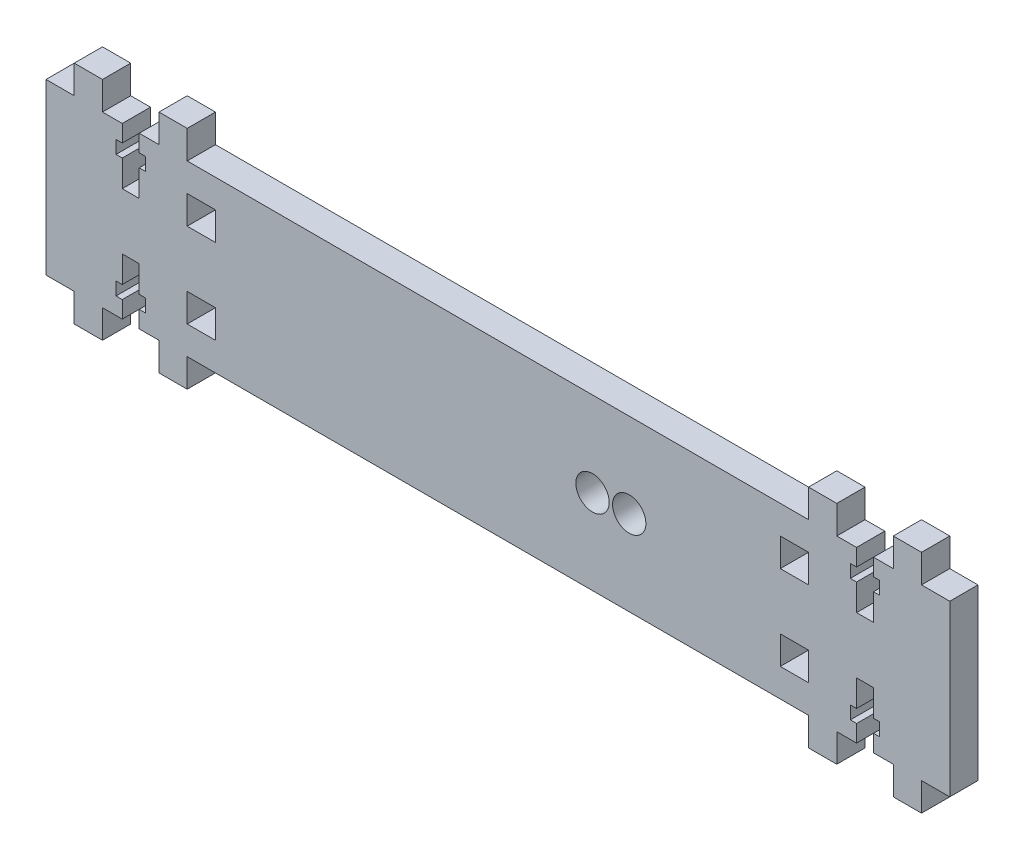
from build123d import *

# Parameters (mm, degrees)
SKETCH2_R           = 2.95
SKETCH2_W           = 5
SKETCH2_H           = 5
BOSS_EXTRUDE1_DEPTH = 5


with BuildPart() as part:
    # Sketch2 → Boss-Extrude1 (new body)
    with BuildSketch(Plane.XY):
        Polygon((66.5, 15), (70, 15), (70, 20), (75, 20), (75, 15), (80, 15), (80, -15), (75, -15), (75, -20), (70, -20), (70, -15), (66.5, -15), (66.5, -12), (67.6, -12), (67.6, -9.7), (66.5, -9.7), (66.5, -5), (63.5, -5), (63.5, -9.7), (62.4, -9.7), (62.4, -12), (63.5, -12), (63.5, -15), (60, -15), (60, -20), (55, -20), (55, -15), (-55, -15), (-55, -20), (-60, -20), (-60, -15), (-63.5, -15), (-63.5, -12), (-62.4, -12), (-62.4, -9.7), (-63.5, -9.7), (-63.5, -5), (-66.5, -5), (-66.5, -9.7), (-67.6, -9.7), (-67.6, -12), (-66.5, -12), (-66.5, -15), (-70, -15), (-70, -20), (-75, -20), (-75, -15), (-80, -15), (-80, 15), (-75, 15), (-75, 20), (-70, 20), (-70, 15), (-66.5, 15), (-66.5, 12), (-67.6, 12), (-67.6, 9.7), (-66.5, 9.7), (-66.5, 5), (-63.5, 5), (-63.5, 9.7), (-62.4, 9.7), (-62.4, 12), (-63.5, 12), (-63.5, 15), (-60, 15), (-60, 20), (-55, 20), (-55, 15), (55, 15), (55, 20), (60, 20), (60, 15), (63.5, 15), (63.5, 12), (62.4, 12), (62.4, 9.7), (63.5, 9.7), (63.5, 5), (66.5, 5), (66.5, 9.7), (67.6, 9.7), (67.6, 12), (66.5, 12), align=None)
        with Locations((23.25, 0)):
            Circle(SKETCH2_R, mode=Mode.SUBTRACT)
        with Locations(Location((16.75, 0, 0), (0, 0, 180))):
            Circle(SKETCH2_R, mode=Mode.SUBTRACT)
        with Locations((52.5, 7.5)):
            Rectangle(SKETCH2_W, SKETCH2_H, mode=Mode.SUBTRACT)
        with Locations((52.5, -7.5)):
            Rectangle(SKETCH2_W, SKETCH2_H, mode=Mode.SUBTRACT)
        with Locations((-52.5, 7.5)):
            Rectangle(SKETCH2_W, SKETCH2_H, mode=Mode.SUBTRACT)
        with Locations((-52.5, -7.5)):
            Rectangle(SKETCH2_W, SKETCH2_H, mode=Mode.SUBTRACT)
    extrude(amount=BOSS_EXTRUDE1_DEPTH)


solid = part.part
